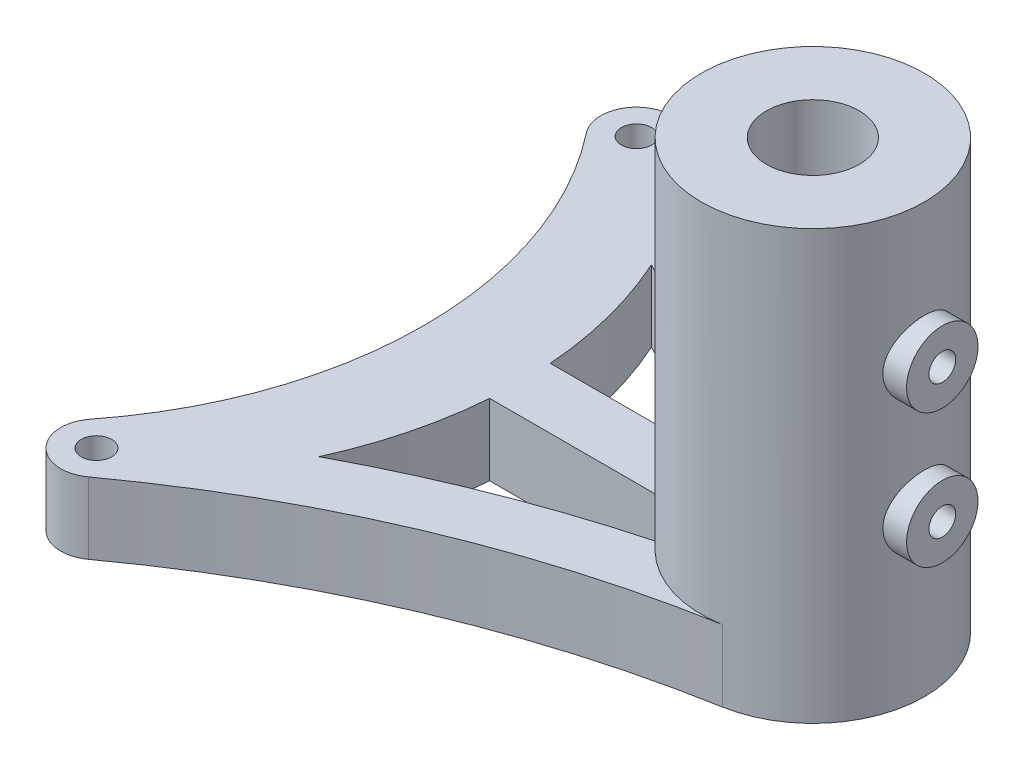
from build123d import *
from build123d.topology import SkipClean

# Parameters (mm, degrees)
SKETCH1_R           = 1.7
SKETCH1_R_2         = 5.2
BOSS_EXTRUDE1_DEPTH = 8
SKETCH2_R           = 12.5
SKETCH2_R_2         = 5.2
BOSS_EXTRUDE2_DEPTH = 40
BOSS_EXTRUDE3_REACH = 90.878
SKETCH3_R           = 4
SKETCH3_R_2         = 1.5
BOSS_EXTRUDE4_START = 2
SKETCH4_R           = 4
SKETCH4_R_2         = 1.5
BOSS_EXTRUDE4_DEPTH = 2
CUT_EXTRUDE4_REACH  = 90.878
SKETCH8_R           = 1.5


with BuildPart() as part:
    # Sketch1 → Boss-Extrude1 (new body)
    with BuildSketch(Plane(origin=(0, 0, 0), x_dir=(1, 0, 0), z_dir=(0, 1, 0))):
        with BuildLine():
            ThreePointArc((-14.326184105, 33.483539106), (-19.559641511, 33.027099632), (-19.827565948, 27.780612245))
            ThreePointArc((-19.827565948, 27.780612245), (-10.22866174, 0), (-19.827565948, -27.780612245))
            ThreePointArc((-19.827565948, -27.780612245), (-19.559641511, -33.027099632), (-14.326184105, -33.483539106))
            ThreePointArc((-14.326184105, -33.483539106), (9.371704904, -20.051603244), (35.488363305, -12.310350215))
            ThreePointArc((35.488363305, -12.310350215), (45.819198123, 0), (35.488363305, 12.310350215))
            ThreePointArc((35.488363305, 12.310350215), (9.371704904, 20.051603244), (-14.326184105, 33.483539106))
        make_face()
        with Locations(Location((-16.680801877, 30.25, 0), (0, 0, 270))):
            Circle(SKETCH1_R, mode=Mode.SUBTRACT)
        with Locations(Location((-16.680801877, -30.25, 0), (0, 0, 270))):
            Circle(SKETCH1_R, mode=Mode.SUBTRACT)
        with Locations(Location((33.319198123, 0, 0), (0, 0, 270))):
            Circle(SKETCH1_R_2, mode=Mode.SUBTRACT)
        with BuildLine():
            Line((0.514993968, -3.4), (21.290482481, -3.4))
            ThreePointArc((21.290482481, -3.4), (22.248655335, -5.804574263), (23.681538207, -7.960245684))
            ThreePointArc((23.681538207, -7.960245684), (9.837951896, -12.513568888), (-3.391753635, -18.625240159))
            ThreePointArc((-3.391753635, -18.625240159), (-0.768460507, -11.184519222), (0.514993968, -3.4))
        make_face(mode=Mode.SUBTRACT)
        with BuildLine():
            Line((0.514993968, 3.4), (21.290482481, 3.4))
            ThreePointArc((21.290482481, 3.4), (22.248655335, 5.804574263), (23.681538207, 7.960245684))
            ThreePointArc((23.681538207, 7.960245684), (9.837951896, 12.513568888), (-3.391753635, 18.625240159))
            ThreePointArc((-3.391753635, 18.625240159), (-0.768460507, 11.184519222), (0.514993968, 3.4))
        make_face(mode=Mode.SUBTRACT)
    extrude(amount=BOSS_EXTRUDE1_DEPTH)

    # Sketch2 → Boss-Extrude2 (add)
    with BuildSketch(Plane(origin=(0, 8, 0), x_dir=(1, 0, 0), z_dir=(0, 1, 0))):
        with Locations(Location((33.319198123, 0, 0), (0, 0, 80.006688446))):
            Circle(SKETCH2_R)
        with Locations(Location((33.319198123, 0, 0), (0, 0, 270))):
            Circle(SKETCH2_R_2, mode=Mode.SUBTRACT)
    extrude(amount=BOSS_EXTRUDE2_DEPTH)

    # Sketch3 → Boss-Extrude3 (add, up to next)
    with BuildSketch(Plane(origin=(45.819198123, 0, 0), x_dir=(0, 0, -1), z_dir=(1, 0, 0)), mode=Mode.PRIVATE) as boss_extrude3_sk1:
        with Locations((0, 33)):
            Circle(SKETCH3_R)
        with Locations((0, 33)):
            Circle(SKETCH3_R_2, mode=Mode.SUBTRACT)
    boss_extrude3_tool1 = extrude(boss_extrude3_sk1.sketch, amount=-BOSS_EXTRUDE3_REACH, mode=Mode.PRIVATE) - part.part
    # Sketch3 → Boss-Extrude3 (add, up to next)
    with BuildSketch(Plane(origin=(45.819198123, 0, 0), x_dir=(0, 0, -1), z_dir=(1, 0, 0)), mode=Mode.PRIVATE) as boss_extrude3_sk2:
        with Locations((0, 18)):
            Circle(SKETCH3_R)
        with Locations((0, 18)):
            Circle(SKETCH3_R_2, mode=Mode.SUBTRACT)
    boss_extrude3_tool2 = extrude(boss_extrude3_sk2.sketch, amount=-BOSS_EXTRUDE3_REACH, mode=Mode.PRIVATE) - part.part
    add(boss_extrude3_tool1.solids().sort_by_distance((45.819198, 33, 3.886863))[0])
    add(boss_extrude3_tool1.solids().sort_by_distance((45.819198, 33, 3.886863))[1])
    add(boss_extrude3_tool2.solids().sort_by_distance((45.819198, 18, 3.886863))[0])
    add(boss_extrude3_tool2.solids().sort_by_distance((45.819198, 18, 3.886863))[1])

    # Sketch4 → Boss-Extrude4 (add)
    # profile 1 of 2: a face of its own
    with BuildSketch(Plane(origin=(45.819198123, 0, 0), x_dir=(0, 0, -1), z_dir=(1, 0, 0)).offset(BOSS_EXTRUDE4_START)):
        with Locations((0, 33)):
            Circle(SKETCH4_R)
        with Locations((0, 33)):
            Circle(SKETCH4_R_2, mode=Mode.SUBTRACT)
    # profile 2 of 2: a face of its own
    with BuildSketch(Plane(origin=(45.819198123, 0, 0), x_dir=(0, 0, -1), z_dir=(1, 0, 0)).offset(BOSS_EXTRUDE4_START)):
        with Locations((0, 18)):
            Circle(SKETCH4_R)
        with Locations((0, 18)):
            Circle(SKETCH4_R_2, mode=Mode.SUBTRACT)
    extrude(amount=-BOSS_EXTRUDE4_DEPTH)

    # Sketch8 → Cut-Extrude4 (cut, up to next)
    with BuildSketch(Plane(origin=(45.819198123, 0, 0), x_dir=(0, 0, -1), z_dir=(1, 0, 0)), mode=Mode.PRIVATE) as cut_extrude4_sk1:
        with Locations((0, 33)):
            Circle(SKETCH8_R)
    cut_extrude4_tool1 = extrude(cut_extrude4_sk1.sketch, amount=-CUT_EXTRUDE4_REACH, mode=Mode.PRIVATE) & part.part
    # Sketch8 → Cut-Extrude4 (cut, up to next)
    with BuildSketch(Plane(origin=(45.819198123, 0, 0), x_dir=(0, 0, -1), z_dir=(1, 0, 0)), mode=Mode.PRIVATE) as cut_extrude4_sk2:
        with Locations((0, 18)):
            Circle(SKETCH8_R)
    cut_extrude4_tool2 = extrude(cut_extrude4_sk2.sketch, amount=-CUT_EXTRUDE4_REACH, mode=Mode.PRIVATE) & part.part
    add(cut_extrude4_tool1.solids().sort_by_distance((45.819198, 33, 0))[0], mode=Mode.SUBTRACT)
    add(cut_extrude4_tool2.solids().sort_by_distance((45.819198, 18, 0))[0], mode=Mode.SUBTRACT)


solid = part.part
